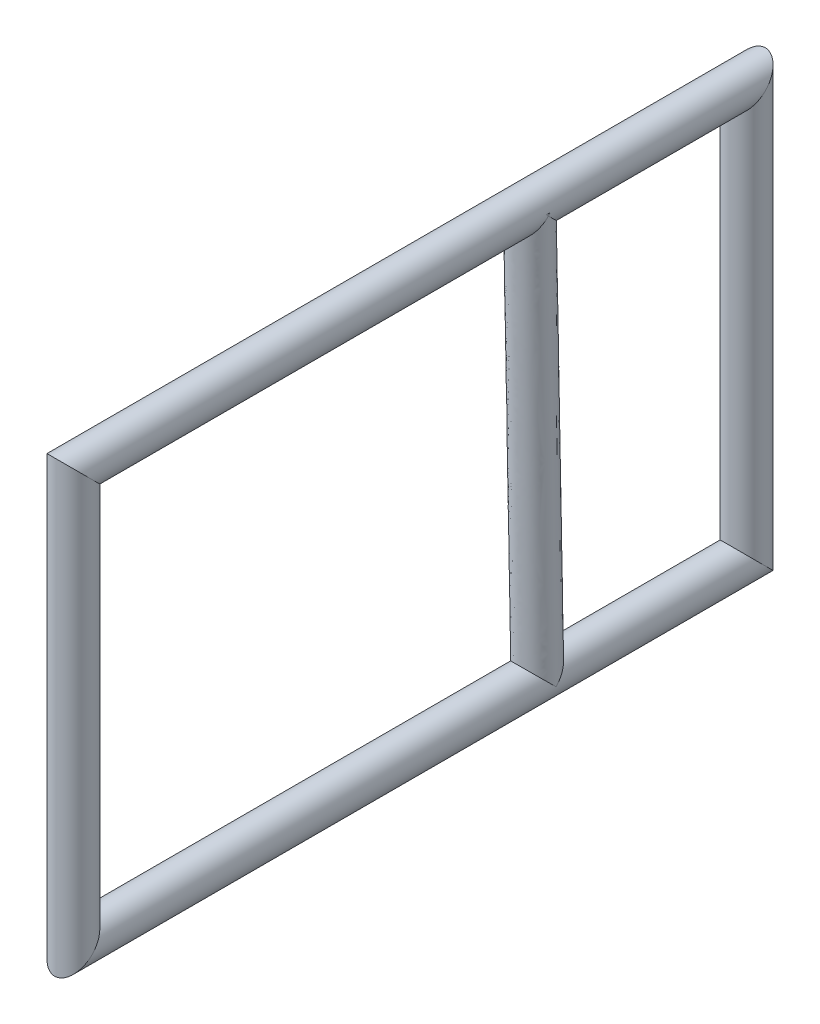
from build123d import *

# Parameters (mm, degrees)
SKETCH2_R = 12.7
SKETCH5_R = 12.7


with BuildPart() as part:
    # Sweep1: sweep along a path in Sketch3
    with BuildLine(Plane(origin=(0, 0, 0), x_dir=(0, 0, -1), z_dir=(1, 0, 0))) as sweep1_path:
        Line((0, 0), (-457.2, 0))
        Line((-457.2, 0), (-457.2, 279.4))
        Line((-457.2, 279.4), (0, 279.4))
        Line((0, 279.4), (0, 0))
    # Sketch2 → Sweep1 (sweep)
    with BuildSketch(Plane.XY):
        Circle(SKETCH2_R)
    sweep(path=sweep1_path.line, transition=Transition.RIGHT)

    # Sweep2: sweep along a path in Sketch4
    with BuildLine(Plane(origin=(0, 0, 0), x_dir=(0, 0, -1), z_dir=(1, 0, 0))) as sweep2_path:
        Line((-142.063950703, 0), (-147.331360877, 280.791318963))
    # Sketch5 → Sweep2 (sweep)
    with BuildSketch(Plane(origin=(0, 0, 0), x_dir=(1, 0, 0), z_dir=(0, 1, 0))):
        with Locations((0, -142.063950703)):
            Circle(SKETCH5_R)
    sweep(path=sweep2_path.line)


solid = part.part
